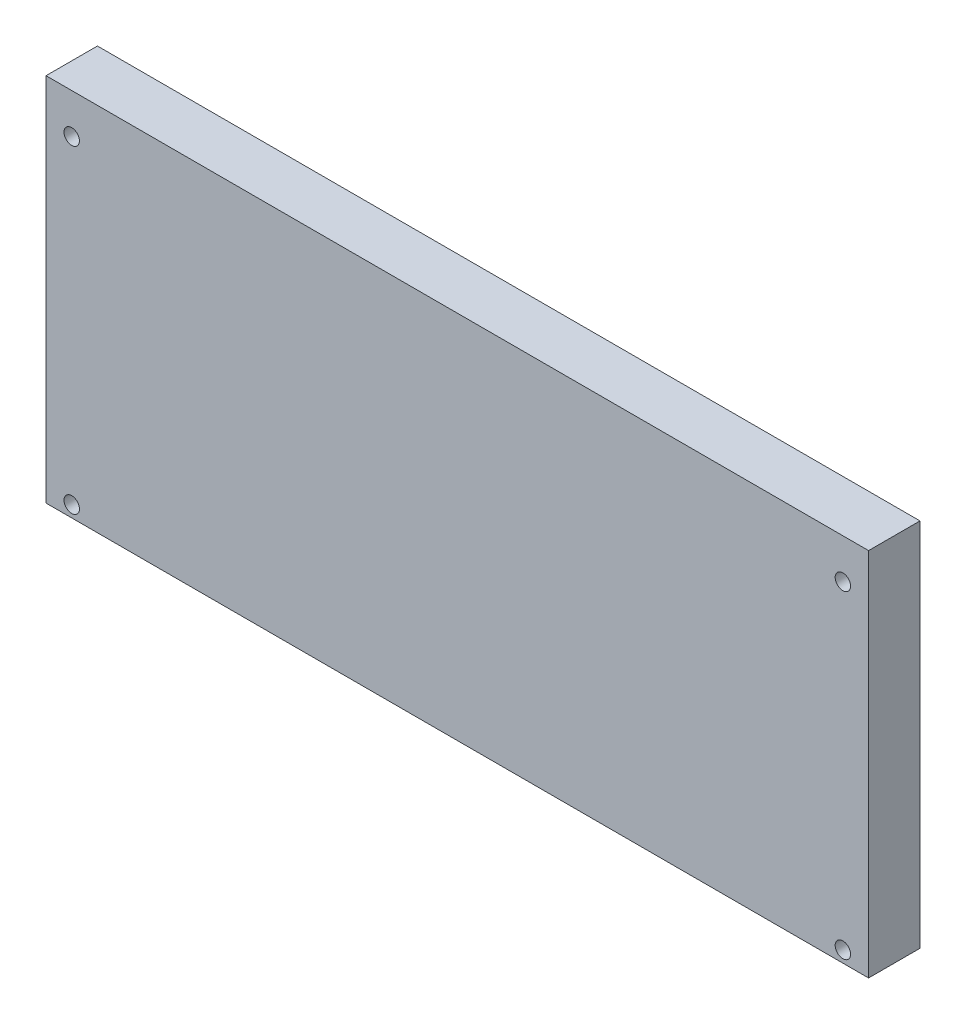
from build123d import *

# Parameters (mm, degrees)
SKETCH1_W           = 80
SKETCH1_H           = 36
BOSS_EXTRUDE1_DEPTH = 5
SKETCH2_W           = 71
SKETCH2_H           = 23.8
BOSS_EXTRUDE2_DEPTH = 2
CUT_EXTRUDE1_REACH  = 345.946
SKETCH3_R           = 0.75


with BuildPart() as part:
    # Sketch1 → Boss-Extrude1 (new body)
    with BuildSketch(Plane.XY):
        with Locations((298.531964754, 42.3820547)):
            Rectangle(SKETCH1_W, SKETCH1_H)
    extrude(amount=BOSS_EXTRUDE1_DEPTH)

    # Sketch2 → Boss-Extrude2 (add)
    with BuildSketch(Plane(origin=(0, 0, 0), x_dir=(-1, 0, 0), z_dir=(0, 0, -1))):
        with Locations((-298.601806293, 42.312213161)):
            Rectangle(SKETCH2_W, SKETCH2_H)
    extrude(amount=BOSS_EXTRUDE2_DEPTH)

    # Sketch3 → Cut-Extrude1 (cut, up to next)
    with BuildSketch(Plane.XY.offset(5), mode=Mode.PRIVATE) as cut_extrude1_sk1:
        with Locations((261.031964754, 25.5070547)):
            Circle(SKETCH3_R)
    cut_extrude1_tool1 = extrude(cut_extrude1_sk1.sketch, amount=-CUT_EXTRUDE1_REACH, mode=Mode.PRIVATE) & part.part
    # Sketch3 → Cut-Extrude1 (cut, up to next)
    with BuildSketch(Plane.XY.offset(5), mode=Mode.PRIVATE) as cut_extrude1_sk2:
        with Locations((336.031964754, 25.5070547)):
            Circle(SKETCH3_R)
    cut_extrude1_tool2 = extrude(cut_extrude1_sk2.sketch, amount=-CUT_EXTRUDE1_REACH, mode=Mode.PRIVATE) & part.part
    # Sketch3 → Cut-Extrude1 (cut, up to next)
    with BuildSketch(Plane.XY.offset(5), mode=Mode.PRIVATE) as cut_extrude1_sk3:
        with Locations((336.031964754, 56.5070547)):
            Circle(SKETCH3_R)
    cut_extrude1_tool3 = extrude(cut_extrude1_sk3.sketch, amount=-CUT_EXTRUDE1_REACH, mode=Mode.PRIVATE) & part.part
    # Sketch3 → Cut-Extrude1 (cut, up to next)
    with BuildSketch(Plane.XY.offset(5), mode=Mode.PRIVATE) as cut_extrude1_sk4:
        with Locations((261.031964754, 56.5070547)):
            Circle(SKETCH3_R)
    cut_extrude1_tool4 = extrude(cut_extrude1_sk4.sketch, amount=-CUT_EXTRUDE1_REACH, mode=Mode.PRIVATE) & part.part
    add(cut_extrude1_tool1.solids().sort_by_distance((261.031965, 25.507055, 5))[0], mode=Mode.SUBTRACT)
    add(cut_extrude1_tool2.solids().sort_by_distance((336.031965, 25.507055, 5))[0], mode=Mode.SUBTRACT)
    add(cut_extrude1_tool3.solids().sort_by_distance((336.031965, 56.507055, 5))[0], mode=Mode.SUBTRACT)
    add(cut_extrude1_tool4.solids().sort_by_distance((261.031965, 56.507055, 5))[0], mode=Mode.SUBTRACT)


solid = part.part
